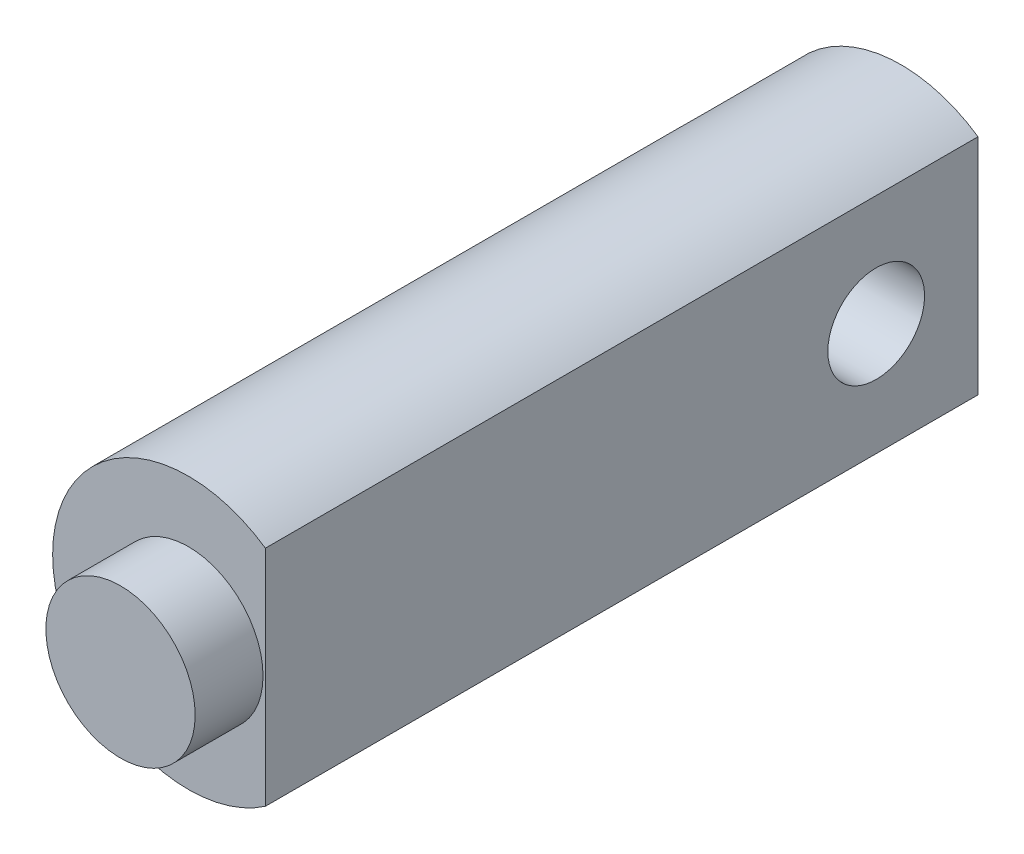
from build123d import *

# Parameters (mm, degrees)
SKETCH1_R           = 11
BOSS_EXTRUDE1_DEPTH = 10
SKETCH2_R           = 20
BOSS_EXTRUDE2_DEPTH = 105
CUT_EXTRUDE1_DEPTH  = 109.742815855
SKETCH5_R           = 7.125
CUT_EXTRUDE2_DEPTH  = 109.742815988
CUT_EXTRUDE3_START  = -105
CUT_EXTRUDE3_DEPTH  = 105


with BuildPart() as part:
    # Sketch1 → Boss-Extrude1 (new body)
    with BuildSketch(Plane.XY):
        Circle(SKETCH1_R)
    extrude(amount=BOSS_EXTRUDE1_DEPTH)

    # Sketch2 → Boss-Extrude2 (add)
    with BuildSketch(Plane(origin=(0, 0, 0), x_dir=(-1, 0, 0), z_dir=(0, 0, -1))):
        Circle(SKETCH2_R)
    extrude(amount=BOSS_EXTRUDE2_DEPTH)

    # Sketch3 → Cut-Extrude1 (cut, through all)
    with BuildSketch(Plane(origin=(0, 0, 0), x_dir=(0, 0, -1), z_dir=(1, 0, 0))):
        with BuildLine():
            Line((139.625, 14.75), (89.625, 14.75))
            ThreePointArc((89.625, 14.75), (75, 0.125), (89.625, -14.5))
            Line((89.625, -14.5), (139.625, -14.5))
            Line((139.625, -14.5), (139.625, 14.75))
        make_face()
    extrude(amount=-CUT_EXTRUDE1_DEPTH, mode=Mode.SUBTRACT)

    # Sketch5 → Cut-Extrude2 (cut, through all)
    with BuildSketch(Plane.ZY):
        with Locations((-90, 0.125)):
            Circle(SKETCH5_R)
    extrude(amount=-CUT_EXTRUDE2_DEPTH, mode=Mode.SUBTRACT)

    # Sketch6 → Cut-Extrude3 (cut)
    with BuildSketch(Plane(origin=(0, 0, -105), x_dir=(-1, 0, 0), z_dir=(0, 0, -1)).offset(CUT_EXTRUDE3_START)):
        with BuildLine():
            Line((-11.346386998, 16.469957562), (-11.346386998, -16.469957562))
            ThreePointArc((-11.346386998, -16.469957562), (-20, 0), (-11.346386998, 16.469957562))
        make_face()
    extrude(amount=CUT_EXTRUDE3_DEPTH, mode=Mode.SUBTRACT)


solid = part.part
